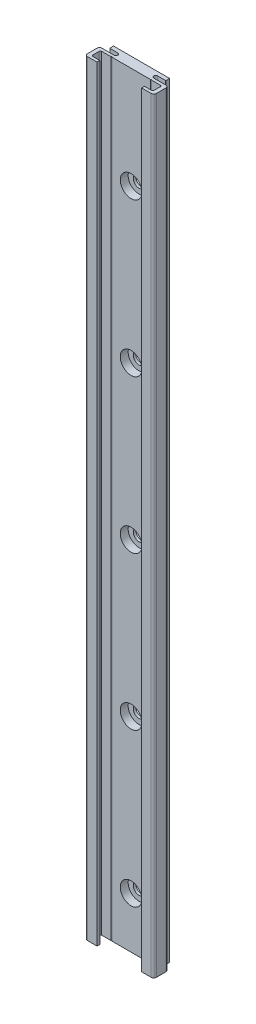
from build123d import *

# Parameters (mm, degrees)
BOSS_EXTRUDE1_DEPTH                              = 300
CUT_EXTRUDE1_DEPTH                               = 301.429592417
F_0_4_0_4_DIAMETER_HOLE1_D                       = 0.4
CBORE_FOR_M4_HEX_HEAD_MACHINE_SCREW1_D           = 4.5
CBORE_FOR_M4_HEX_HEAD_MACHINE_SCREW1_CBORE_D     = 8.5
CBORE_FOR_M4_HEX_HEAD_MACHINE_SCREW1_CBORE_DEPTH = 3.1
FILLET1_R                                        = 0.2
FILLET2_R                                        = 0.5
FILLET3_R                                        = 1


with BuildPart() as part:
    # Sketch1 → Boss-Extrude1 (new body)
    with BuildSketch(Plane(origin=(0, 300, 0), x_dir=(1, 0, 0), z_dir=(0, 1, 0))):
        with BuildLine():
            Line((-13.5, -3), (-13.5, -8.7))
            Line((-13.5, -8.7), (13.5, -8.7))
            Line((13.5, -8.7), (13.5, -3))
            Line((13.5, -3), (7.8, -3))
            ThreePointArc((7.8, -3), (7.05, -2.25), (7.8, -1.5))
            Line((7.8, -1.5), (11, -1.5))
            Line((11, -1.5), (11, 0))
            Line((11, 0), (-11, 0))
            Line((-11, 0), (-11, -1.5))
            Line((-11, -1.5), (-7.8, -1.5))
            ThreePointArc((-7.8, -1.5), (-7.05, -2.25), (-7.8, -3))
            Line((-7.8, -3), (-13.5, -3))
        make_face()
    extrude(amount=-BOSS_EXTRUDE1_DEPTH)

    # Sketch2 → Cut-Extrude1 (cut, through all)
    with BuildSketch(Plane.XZ):
        Polygon((8.75, 8.7), (-8.75, 8.7), (-8.75, 7.6), (-12, 7.6), (-12, 4.1), (12, 4.1), (12, 7.6), (8.75, 7.6), align=None)
    extrude(amount=-CUT_EXTRUDE1_DEPTH, mode=Mode.SUBTRACT)

    # Ø0.4 (0.4) Diameter Hole1 (through all)
    with Locations(Plane(origin=(0, 300, 0), x_dir=(1, 0, 0), z_dir=(0, 1, 0))):
        with Locations((-7.75, -4.1), (7.75, -4.1)):
            Hole(F_0_4_0_4_DIAMETER_HOLE1_D / 2)

    # CBORE for M4 Hex Head Machine Screw1 (through all)
    with Locations(Plane.XY.offset(4.1)):
        with Locations((0, 260), (0, 200), (0, 140), (0, 80), (0, 20)):
            CounterBoreHole(CBORE_FOR_M4_HEX_HEAD_MACHINE_SCREW1_D / 2, CBORE_FOR_M4_HEX_HEAD_MACHINE_SCREW1_CBORE_D / 2, CBORE_FOR_M4_HEX_HEAD_MACHINE_SCREW1_CBORE_DEPTH)

    # Fillet1
    fillet1_edges = [part.edges().sort_by_distance(p)[0] for p in [
        (-11, 150, 1.5),
        (11, 150, 1.5),
    ]]
    fillet(fillet1_edges, radius=FILLET1_R)

    # Fillet2
    fillet2_edges = [part.edges().sort_by_distance(p)[0] for p in [
        (12, 150, 7.6),
        (12, 150, 4.1),
        (-12, 150, 4.1),
        (-12, 150, 7.6),
    ]]
    fillet(fillet2_edges, radius=FILLET2_R)

    # Fillet3
    fillet3_edges = [part.edges().sort_by_distance(p)[0] for p in [
        (13.5, 150, 3),
        (13.5, 150, 8.7),
        (-13.5, 150, 8.7),
        (-13.5, 150, 3),
    ]]
    fillet(fillet3_edges, radius=FILLET3_R)


solid = part.part
